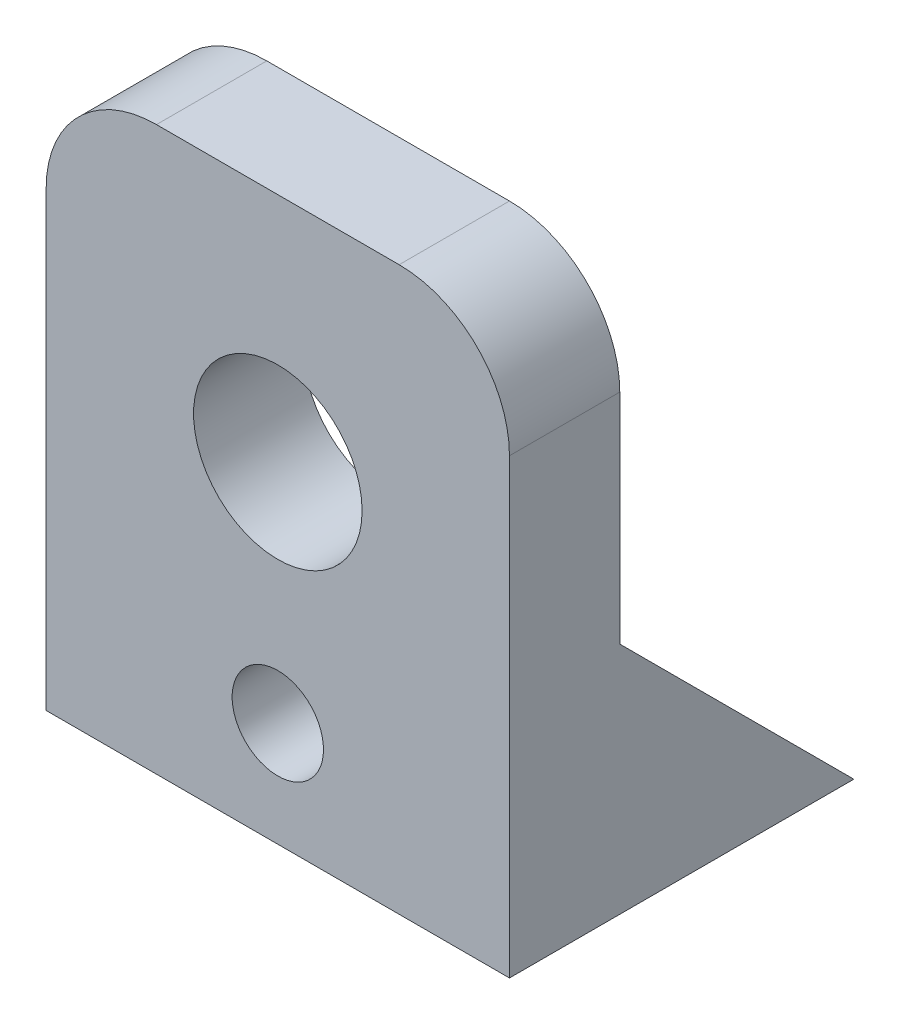
from build123d import *

# Parameters (mm, degrees)
SKETCH1_R           = 7.64
SKETCH1_R_2         = 4.14
BOSS_EXTRUDE1_DEPTH = 10
BOSS_EXTRUDE2_DEPTH = 10


with BuildPart() as part:
    # Sketch1 → Boss-Extrude1 (new body)
    with BuildSketch(Plane.XY):
        with BuildLine():
            Line((-7.444896481, 30.480652594), (-29.444896481, 30.480652594))
            ThreePointArc((-29.444896481, 30.480652594), (-36.515964293, 27.551720406), (-39.444896481, 20.480652594))
            Line((-39.444896481, 20.480652594), (-39.444896481, -20.519347406))
            Line((-39.444896481, -20.519347406), (2.555103519, -20.519347406))
            Line((2.555103519, -20.519347406), (2.555103519, 20.480652594))
            ThreePointArc((2.555103519, 20.480652594), (-0.373828669, 27.551720406), (-7.444896481, 30.480652594))
        make_face()
        with Locations((-18.444896481, 9.480652594)):
            Circle(SKETCH1_R, mode=Mode.SUBTRACT)
        with Locations((-18.444896481, -11.019347406)):
            Circle(SKETCH1_R_2, mode=Mode.SUBTRACT)
    extrude(amount=-BOSS_EXTRUDE1_DEPTH)

    # Sketch2 → Boss-Extrude2 (add)
    with BuildSketch(Plane(origin=(2.555103519, 0, 0), x_dir=(0, 0, -1), z_dir=(1, 0, 0))):
        Polygon((10, 0.69821188), (31.217559285, -20.519347406), (10, -20.519347406), align=None)
    extrude(amount=-BOSS_EXTRUDE2_DEPTH)


solid = part.part
